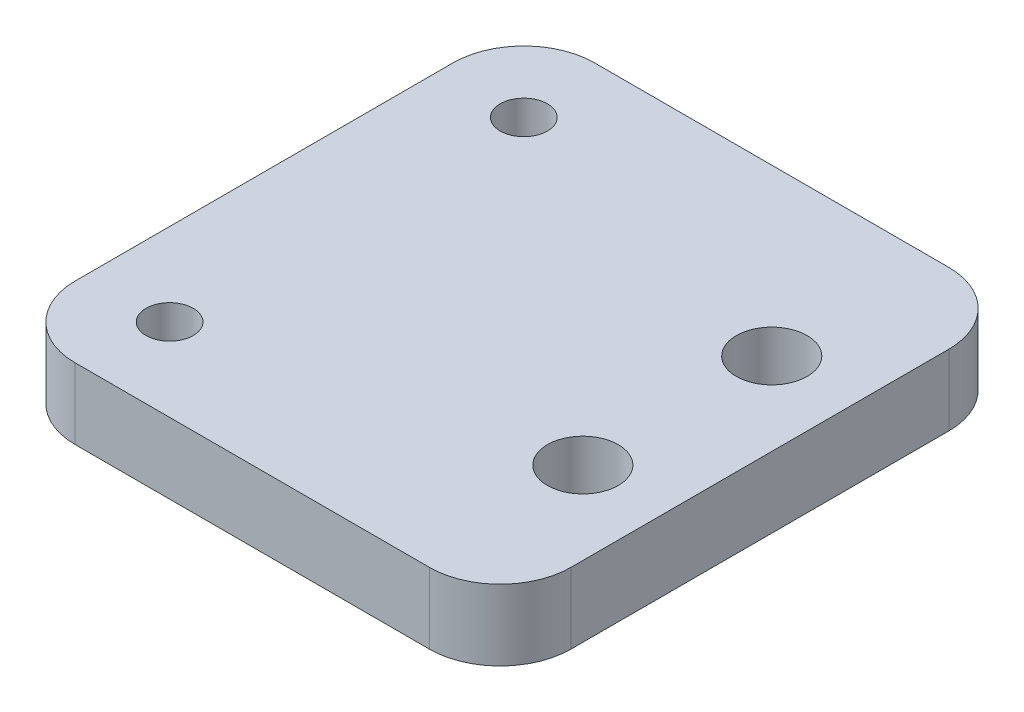
from build123d import *

# Parameters (mm, degrees)
SKETCH_1_W      = 7
SKETCH_1_H      = 22
SKETCH_1_R      = 1
SKETCH_1_W_2    = 14
SKETCH_1_R_2    = 1.5
EXTRUDE_1_DEPTH = 3
FILLET_1_R      = 3


with BuildPart() as part:
    # 草图1 → 凸台-拉伸1 (new body)
    # profile 1 of 2: a face of its own
    with BuildSketch(Plane(origin=(0, 0, 0), x_dir=(1, 0, 0), z_dir=(0, 1, 0))):
        Rectangle(SKETCH_1_W, SKETCH_1_H)
        with Locations(Location((0, -7.5, 0), (0, 0, 270))):
            Circle(SKETCH_1_R, mode=Mode.SUBTRACT)
        with Locations(Location((0, 7.5, 0), (0, 0, 270))):
            Circle(SKETCH_1_R, mode=Mode.SUBTRACT)
    # profile 2 of 2: a face of its own
    with BuildSketch(Plane(origin=(0, 0, 0), x_dir=(1, 0, 0), z_dir=(0, 1, 0))):
        with Locations((10.5, 0)):
            Rectangle(SKETCH_1_W_2, SKETCH_1_H)
        with Locations(Location((14, -4, 0), (0, 0, 270))):
            Circle(SKETCH_1_R_2, mode=Mode.SUBTRACT)
        with Locations(Location((14, 4, 0), (0, 0, 270))):
            Circle(SKETCH_1_R_2, mode=Mode.SUBTRACT)
    extrude(amount=EXTRUDE_1_DEPTH)

    # 圆角1
    fillet_1_edges = [part.edges().sort_by_distance(p)[0] for p in [
        (-3.5, 1.5, 11),
        (-3.5, 1.5, -11),
        (17.5, 1.5, -11),
        (17.5, 1.5, 11),
    ]]
    fillet(fillet_1_edges, radius=FILLET_1_R)


solid = part.part
